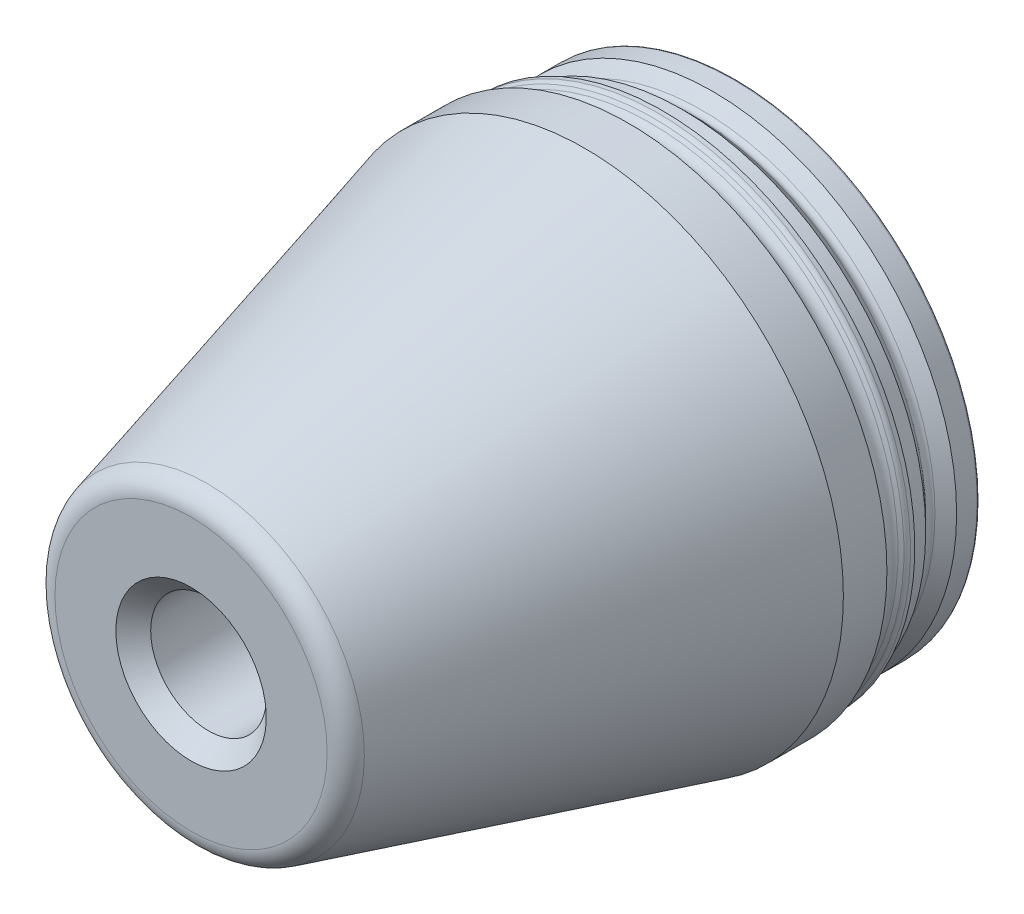
from build123d import *


with BuildPart() as part:
    # Sketch3 → FBR-00 Basic blank revolve. (revolve)
    with BuildSketch(Plane(origin=(0, 0, 0), x_dir=(0, 0, -1), z_dir=(1, 0, 0))):
        with BuildLine():
            Line((-53.109996064, 18.328023479), (-9.057762175, 30.1625))
            Line((-9.057762175, 30.1625), (-3.977762175, 30.1625))
            Line((-3.977762175, 30.1625), (-3.385852263, 29.137281959))
            ThreePointArc((-3.385852263, 29.137281959), (-2.451768264, 28.513146985), (-1.387974388, 28.874256347))
            Line((-1.387974388, 28.874256347), (-1.046815367, 29.215415367))
            ThreePointArc((-1.046815367, 29.215415367), (-0.799604775, 29.380596204), (-0.508, 29.4386))
            Line((-0.508, 29.4386), (0, 29.4386))
            Line((0, 29.4386), (0, 28.448))
            Line((0, 28.448), (2.260600025, 28.448))
            Line((2.260600025, 28.448), (3.525184633, 27.183415393))
            ThreePointArc((3.525184633, 27.183415393), (4.064, 26.96023076), (4.602815367, 27.183415393))
            Line((4.602815367, 27.183415393), (5.867399975, 28.448))
            Line((5.867399975, 28.448), (8.255, 28.448))
            ThreePointArc((8.255, 28.448), (8.434605122, 28.373605122), (8.509, 28.194))
            Line((8.509, 28.194), (8.509, 24.1935))
            Line((8.509, 24.1935), (8.128, 23.8125))
            Line((8.128, 23.8125), (-7.366, 23.8125))
            Line((-7.366, 23.8125), (-11.939571176, 6.7437))
            Line((-11.939571176, 6.7437), (-52.959, 6.7437))
            Line((-52.959, 6.7437), (-54.991, 8.7757))
            Line((-54.991, 8.7757), (-54.991, 15.875))
            ThreePointArc((-54.991, 15.875), (-54.466620252, 17.420598589), (-53.109996064, 18.328023479))
        make_face()
    revolve(axis=Axis((0, 0, 47.572309729), (0, 0, 1)))


solid = part.part
